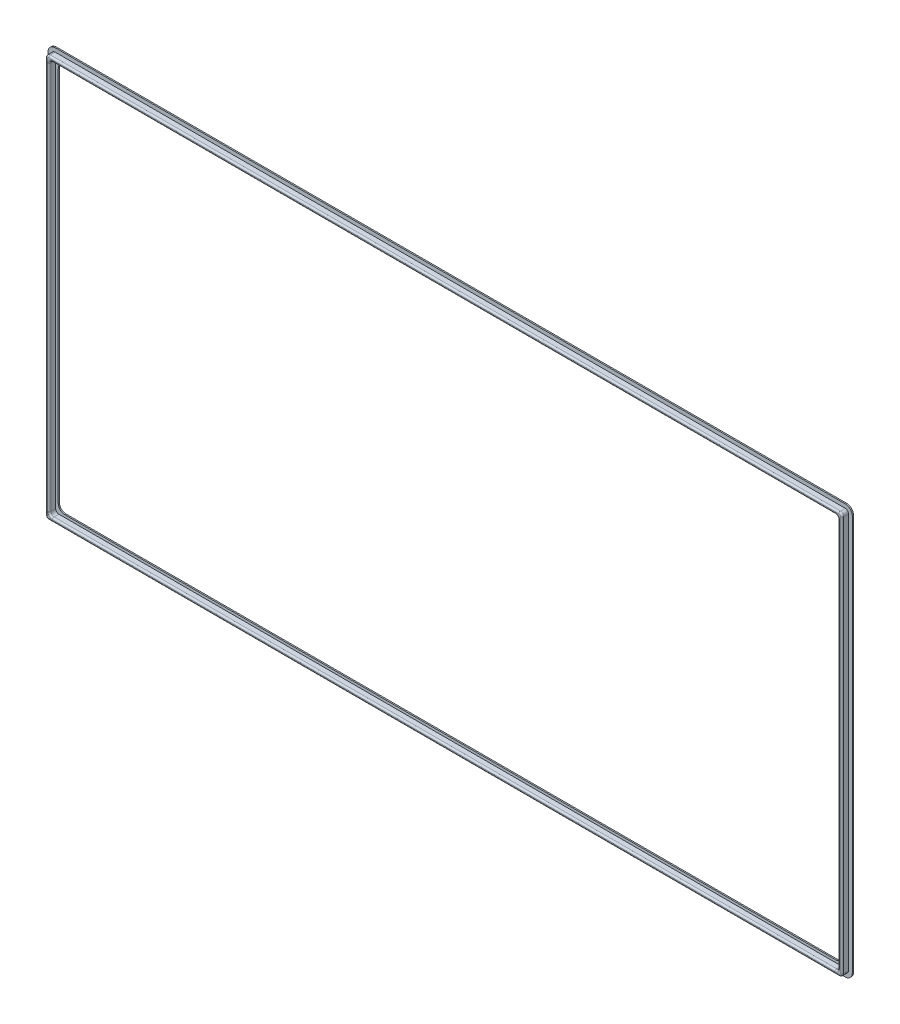
from build123d import *

# Parameters (mm, degrees)
SKIZZE1_W                       = 250.4
SKIZZE1_H                       = 126.4
SKIZZE1_W_2                     = 248
SKIZZE1_H_2                     = 124
AUFSATZ_LINEAR_AUSTRAGEN1_DEPTH = 2.4
VERRUNDUNG1_R                   = 1
VERRUNDUNG2_R                   = 0.5
AUFSATZ_LINEAR_START            = -0.4
AUFSATZ_LINEAR_AUSTRAGEN2_DEPTH = 0.4
SKIZZE3_W                       = 246.4
SKIZZE3_H                       = 122.4
AUFSATZ_LINEAR_AUSTRAGEN3_DEPTH = 0.4
VERRUNDUNG3_R                   = 2


with BuildPart() as part:
    # Skizze1 → Aufsatz-Linear austragen1 (new body)
    with BuildSketch(Plane.XY):
        with Locations((125.2, -63.2)):
            Rectangle(SKIZZE1_W, SKIZZE1_H)
        with Locations((125.2, -63.2)):
            Rectangle(SKIZZE1_W_2, SKIZZE1_H_2, mode=Mode.SUBTRACT)
    extrude(amount=AUFSATZ_LINEAR_AUSTRAGEN1_DEPTH)

    # Verrundung1
    verrundung1_edges = [part.edges().sort_by_distance(p)[0] for p in [
        (1.2, -1.2, 1.2),
        (1.2, -125.2, 1.2),
        (249.2, -125.2, 1.2),
        (249.2, -1.2, 1.2),
        (0, 0, 1.2),
        (250.4, 0, 1.2),
        (250.4, -126.4, 1.2),
        (0, -126.4, 1.2),
    ]]
    fillet(verrundung1_edges, radius=VERRUNDUNG1_R)

    # Verrundung2
    verrundung2_edges = [part.edges().sort_by_distance(p)[0] for p in [
        (249.2, -63.2, 2.4),
        (125.2, -1.2, 2.4),
        (125.2, -125.2, 2.4),
        (250.4, -63.2, 2.4),
        (125.2, -126.4, 2.4),
        (0, -63.2, 2.4),
        (125.2, 0, 2.4),
        (1.2, -63.2, 2.4),
        (0.292893219, -0.292893219, 2.4),
        (0.292893219, -126.107106781, 2.4),
        (250.107106781, -0.292893219, 2.4),
        (250.107106781, -126.107106781, 2.4),
        (248.907106781, -1.492893219, 2.4),
        (248.907106781, -124.907106781, 2.4),
        (1.492893219, -124.907106781, 2.4),
        (1.492893219, -1.492893219, 2.4),
    ]]
    fillet(verrundung2_edges, radius=VERRUNDUNG2_R)

    # Skizze2 → Aufsatz-Linear austragen2 (add)
    with BuildSketch(Plane(origin=(0, 0, 0), x_dir=(-1, 0, 0), z_dir=(0, 0, -1)).offset(AUFSATZ_LINEAR_START)):
        with BuildLine():
            Line((-1, 1.2), (-249.4, 1.2))
            ThreePointArc((-249.4, 1.2), (-250.955634919, 0.555634919), (-251.6, -1))
            Line((-251.6, -1), (-251.6, -125.4))
            ThreePointArc((-251.6, -125.4), (-250.955634919, -126.955634919), (-249.4, -127.6))
            Line((-249.4, -127.6), (-1, -127.6))
            ThreePointArc((-1, -127.6), (0.555634919, -126.955634919), (1.2, -125.4))
            Line((1.2, -125.4), (1.2, -1))
            ThreePointArc((1.2, -1), (0.555634919, 0.555634919), (-1, 1.2))
        make_face()
        with BuildLine():
            Line((-250.4, -1), (-250.4, -125.4))
            ThreePointArc((-250.4, -125.4), (-250.107106781, -126.107106781), (-249.4, -126.4))
            Line((-249.4, -126.4), (-1, -126.4))
            ThreePointArc((-1, -126.4), (-0.292893219, -126.107106781), (0, -125.4))
            Line((0, -125.4), (0, -1))
            ThreePointArc((0, -1), (-0.292893219, -0.292893219), (-1, 0))
            Line((-1, 0), (-249.4, 0))
            ThreePointArc((-249.4, 0), (-250.107106781, -0.292893219), (-250.4, -1))
        make_face(mode=Mode.SUBTRACT)
    extrude(amount=AUFSATZ_LINEAR_AUSTRAGEN2_DEPTH)

    # Skizze3 → Aufsatz-Linear austragen3 (add)
    with BuildSketch(Plane(origin=(0, 0, 0), x_dir=(-1, 0, 0), z_dir=(0, 0, -1)).offset(AUFSATZ_LINEAR_START)):
        with BuildLine():
            Line((-1, 1.2), (-249.4, 1.2))
            ThreePointArc((-249.4, 1.2), (-250.955634919, 0.555634919), (-251.6, -1))
            Line((-251.6, -1), (-251.6, -125.4))
            ThreePointArc((-251.6, -125.4), (-250.955634919, -126.955634919), (-249.4, -127.6))
            Line((-249.4, -127.6), (-1, -127.6))
            ThreePointArc((-1, -127.6), (0.555634919, -126.955634919), (1.2, -125.4))
            Line((1.2, -125.4), (1.2, -1))
            ThreePointArc((1.2, -1), (0.555634919, 0.555634919), (-1, 1.2))
        make_face()
        with Locations((-125.2, -63.2)):
            Rectangle(SKIZZE3_W, SKIZZE3_H, mode=Mode.SUBTRACT)
    extrude(amount=AUFSATZ_LINEAR_AUSTRAGEN3_DEPTH)

    # Verrundung3
    verrundung3_edges = [part.edges().sort_by_distance(p)[0] for p in [
        (2, -124.4, 0.2),
        (248.4, -124.4, 0.2),
        (248.4, -2, 0.2),
        (2, -2, 0.2),
    ]]
    fillet(verrundung3_edges, radius=VERRUNDUNG3_R)


solid = part.part
